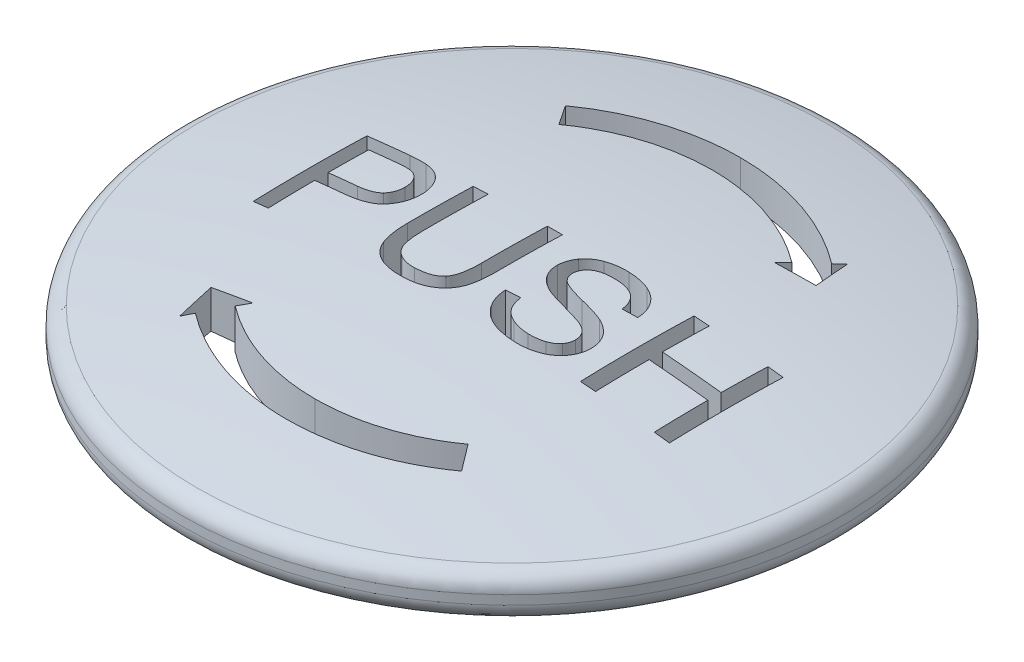
from build123d import *

# Parameters (mm, degrees)
SKETCH2_R           = 10
BOSS_EXTRUDE2_DEPTH = 10
SKETCH9_R           = 18
CUT_EXTRUDE4_DEPTH  = 1.5
SKETCH10_R          = 18
CUT_EXTRUDE5_DEPTH  = 24.9
CUT_EXTRUDE9_DEPTH  = 24.9


with BuildPart() as part:
    # Sketch2 → Boss-Extrude2 (new body)
    with BuildSketch(Plane(origin=(0, 0, 0), x_dir=(1, 0, 0), z_dir=(0, 1, 0))):
        with Locations(Location((0, 0, 0), (0, 0, 270))):
            Circle(SKETCH2_R)
    extrude(amount=BOSS_EXTRUDE2_DEPTH)

    # Sketch4 → Revolve1 (revolve)
    with BuildSketch(Plane.XY, mode=Mode.PRIVATE) as revolve1_sk:
        with BuildLine():
            Line((0, 10), (0, 15))
            ThreePointArc((0, 15), (10.806929535, 14.498925094), (21.521126919, 13))
            ThreePointArc((21.521126919, 13), (22.223404652, 12.586920321), (22.5, 11.820549753))
            Line((22.5, 11.820549753), (22.5, 11.2))
            ThreePointArc((22.5, 11.2), (22.148528137, 10.351471863), (21.3, 10))
            Line((21.3, 10), (0, 10))
        make_face()
    revolve(revolve1_sk.sketch.rotate(Axis((0, 10, 0), (0, 1, 0)), 90), axis=Axis((0, 10, 0), (0, 1, 0)))

    # Sketch9 → Cut-Extrude4 (cut)
    with BuildSketch(Plane.XZ.offset(-10)):
        with Locations(Location((0, 0, 0), (0, 0, 270))):
            Circle(SKETCH9_R)
    extrude(amount=-CUT_EXTRUDE4_DEPTH, mode=Mode.SUBTRACT)


with BuildPart() as cut_extrude4_piece_1:
    # of the separate pieces the step leaves, piece 1, a body of its own (cut_extrude4_pieces)
    add(part.part.solids().sort_by_distance((0, 15, 0))[0])

    # Sketch16 → Cut-Extrude9 (cut)
    # profile 1 of 6: a face of its own
    with BuildSketch(Plane(origin=(0, 0, 0), x_dir=(1, 0, 0), z_dir=(0, 1, 0))):
        with BuildLine():
            Line((10.256560718, 10.500710718), (7.684000718, 10.221350718))
            Line((7.684000718, 10.221350718), (8.206900718, 10.901930718))
            add(Edge.make_bspline(
                [(8.206900718, 10.901930718), (5.845840718, 12.699050718), (2.960440718, 13.672130718), (-0.006679282, 13.672130718)],
                knots=[0.2, 0.2, 0.2, 0.2, 0.3, 0.3, 0.3, 0.3], degree=3))
            add(Edge.make_bspline(
                [(-0.006679282, 13.672130718), (-2.845639282, 13.672130718), (-5.613679282, 12.782030718), (-7.919299282, 11.125490718)],
                knots=[0.3, 0.3, 0.3, 0.3, 0.4, 0.4, 0.4, 0.4], degree=3))
            Line((-7.919299282, 11.125490718), (-9.049159282, 12.698330718))
            add(Edge.make_bspline(
                [(-9.049159282, 12.698330718), (-6.414139282, 14.591210718), (-3.251179282, 15.609470718), (-0.006679282, 15.609470718)],
                knots=[0.5, 0.5, 0.5, 0.5, 0.6, 0.6, 0.6, 0.6], degree=3))
            add(Edge.make_bspline(
                [(-0.006679282, 15.609470718), (3.384340718, 15.609470718), (6.682120718, 14.497610718), (9.380500718, 12.443990718)],
                knots=[0.6, 0.6, 0.6, 0.6, 0.7, 0.7, 0.7, 0.7], degree=3))
            Line((9.380500718, 12.443990718), (9.841120718, 13.049150718))
            Line((9.841120718, 13.049150718), (10.256560718, 10.500710718))
        make_face()
    # profile 2 of 6: a face of its own
    with BuildSketch(Plane(origin=(0, 0, 0), x_dir=(1, 0, 0), z_dir=(0, 1, 0))):
        with BuildLine():
            Line((-10.269919282, -10.279569282), (-7.697359282, -10.000209282))
            Line((-7.697359282, -10.000209282), (-8.220259282, -10.680789282))
            add(Edge.make_bspline(
                [(-8.220259282, -10.680789282), (-5.859199282, -12.477909282), (-2.973799282, -13.450989282), (-0.006679282, -13.450989282)],
                knots=[0.2, 0.2, 0.2, 0.2, 0.3, 0.3, 0.3, 0.3], degree=3))
            add(Edge.make_bspline(
                [(-0.006679282, -13.450989282), (2.832280718, -13.450989282), (5.600320718, -12.560889282), (7.905940718, -10.904349282)],
                knots=[0.3, 0.3, 0.3, 0.3, 0.4, 0.4, 0.4, 0.4], degree=3))
            Line((7.905940718, -10.904349282), (9.035800718, -12.477189282))
            add(Edge.make_bspline(
                [(9.035800718, -12.477189282), (6.400780718, -14.370069282), (3.237820718, -15.388329282), (-0.006679282, -15.388329282)],
                knots=[0.5, 0.5, 0.5, 0.5, 0.6, 0.6, 0.6, 0.6], degree=3))
            add(Edge.make_bspline(
                [(-0.006679282, -15.388329282), (-3.397699282, -15.388329282), (-6.695479282, -14.276469282), (-9.393859282, -12.222849282)],
                knots=[0.6, 0.6, 0.6, 0.6, 0.7, 0.7, 0.7, 0.7], degree=3))
            Line((-9.393859282, -12.222849282), (-9.854479282, -12.828009282))
            Line((-9.854479282, -12.828009282), (-10.269919282, -10.279569282))
        make_face()
    # profile 3 of 6: a face of its own
    with BuildSketch(Plane(origin=(0, 0, 0), x_dir=(1, 0, 0), z_dir=(0, 1, 0))):
        with BuildLine():
            Line((-13.895839282, -3.771669282), (-13.895839282, 3.992630718))
            Line((-13.895839282, 3.992630718), (-10.964359282, 3.992630718))
            add(Edge.make_bspline(
                [(-10.964359282, 3.992630718), (-10.449379282, 3.992630718), (-10.055359282, 3.967250718), (-9.782479282, 3.918470718)],
                knots=[0.166666667, 0.166666667, 0.166666667, 0.166666667, 0.25, 0.25, 0.25, 0.25], degree=3))
            add(Edge.make_bspline(
                [(-9.782479282, 3.918470718), (-9.401059282, 3.855290718), (-9.081199282, 3.734150718), (-8.822719282, 3.557030718)],
                knots=[0.25, 0.25, 0.25, 0.25, 0.333333333, 0.333333333, 0.333333333, 0.333333333], degree=3))
            add(Edge.make_bspline(
                [(-8.822719282, 3.557030718), (-8.564239282, 3.378110718), (-8.356519282, 3.128630718), (-8.199199282, 2.808770718)],
                knots=[0.333333333, 0.333333333, 0.333333333, 0.333333333, 0.416666667, 0.416666667, 0.416666667, 0.416666667], degree=3))
            add(Edge.make_bspline(
                [(-8.199199282, 2.808770718), (-8.041879282, 2.488910718), (-7.964299282, 2.136470718), (-7.964299282, 1.751450718)],
                knots=[0.416666667, 0.416666667, 0.416666667, 0.416666667, 0.5, 0.5, 0.5, 0.5], degree=3))
            add(Edge.make_bspline(
                [(-7.964299282, 1.751450718), (-7.964299282, 1.093550718), (-8.173819282, 0.535190718), (-8.595019282, 0.079790718)],
                knots=[0.5, 0.5, 0.5, 0.5, 0.583333333, 0.583333333, 0.583333333, 0.583333333], degree=3))
            add(Edge.make_bspline(
                [(-8.595019282, 0.079790718), (-9.014239282, -0.377589282), (-9.775099282, -0.605289282), (-10.873999282, -0.605289282)],
                knots=[0.583333333, 0.583333333, 0.583333333, 0.583333333, 0.666666667, 0.666666667, 0.666666667, 0.666666667], degree=3))
            Line((-10.873999282, -0.605289282), (-12.865699282, -0.605289282))
            Line((-12.865699282, -0.605289282), (-12.865699282, -3.771669282))
            Line((-12.865699282, -3.771669282), (-13.895839282, -3.771669282))
        make_face()
        with BuildLine():
            Line((-12.865699282, 0.305690718), (-10.859599282, 0.305690718))
            add(Edge.make_bspline(
                [(-10.859599282, 0.305690718), (-10.194499282, 0.305690718), (-9.724519282, 0.428630718), (-9.444439282, 0.676130718)],
                knots=[0.111111111, 0.111111111, 0.111111111, 0.111111111, 0.222222222, 0.222222222, 0.222222222, 0.222222222], degree=3))
            add(Edge.make_bspline(
                [(-9.444439282, 0.676130718), (-9.166159282, 0.923810718), (-9.027019282, 1.270670718), (-9.027019282, 1.720850718)],
                knots=[0.222222222, 0.222222222, 0.222222222, 0.222222222, 0.333333333, 0.333333333, 0.333333333, 0.333333333], degree=3))
            add(Edge.make_bspline(
                [(-9.027019282, 1.720850718), (-9.027019282, 2.044310718), (-9.108199282, 2.322590718), (-9.272719282, 2.553890718)],
                knots=[0.333333333, 0.333333333, 0.333333333, 0.333333333, 0.444444444, 0.444444444, 0.444444444, 0.444444444], degree=3))
            add(Edge.make_bspline(
                [(-9.272719282, 2.553890718), (-9.437239282, 2.785370718), (-9.654139282, 2.938910718), (-9.921619282, 3.013070718)],
                knots=[0.444444444, 0.444444444, 0.444444444, 0.444444444, 0.555555556, 0.555555556, 0.555555556, 0.555555556], degree=3))
            add(Edge.make_bspline(
                [(-9.921619282, 3.013070718), (-10.095139282, 3.058250718), (-10.414999282, 3.081650718), (-10.879399282, 3.081650718)],
                knots=[0.555555556, 0.555555556, 0.555555556, 0.555555556, 0.666666667, 0.666666667, 0.666666667, 0.666666667], degree=3))
            Line((-10.879399282, 3.081650718), (-12.865699282, 3.081650718))
            Line((-12.865699282, 3.081650718), (-12.865699282, 0.305690718))
        make_face(mode=Mode.SUBTRACT)
    # profile 4 of 6: a face of its own
    with BuildSketch(Plane(origin=(0, 0, 0), x_dir=(1, 0, 0), z_dir=(0, 1, 0))):
        with BuildLine():
            Line((-1.577179282, 3.992630718), (-0.547039282, 3.992630718))
            Line((-0.547039282, 3.992630718), (-0.547039282, -0.491349282))
            add(Edge.make_bspline(
                [(-0.547039282, -0.491349282), (-0.547039282, -1.272189282), (-0.635599282, -1.892109282), (-0.810919282, -2.351109282)],
                knots=[0.111111111, 0.111111111, 0.111111111, 0.111111111, 0.166666667, 0.166666667, 0.166666667, 0.166666667], degree=3))
            add(Edge.make_bspline(
                [(-0.810919282, -2.351109282), (-0.988039282, -2.808309282), (-1.306099282, -3.182529282), (-1.765099282, -3.469809282)],
                knots=[0.166666667, 0.166666667, 0.166666667, 0.166666667, 0.222222222, 0.222222222, 0.222222222, 0.222222222], degree=3))
            add(Edge.make_bspline(
                [(-1.765099282, -3.469809282), (-2.225899282, -3.757269282), (-2.827819282, -3.901809282), (-3.576079282, -3.901809282)],
                knots=[0.222222222, 0.222222222, 0.222222222, 0.222222222, 0.277777778, 0.277777778, 0.277777778, 0.277777778], degree=3))
            add(Edge.make_bspline(
                [(-3.576079282, -3.901809282), (-4.300759282, -3.901809282), (-4.895299282, -3.777069282), (-5.356279282, -3.525789282)],
                knots=[0.277777778, 0.277777778, 0.277777778, 0.277777778, 0.333333333, 0.333333333, 0.333333333, 0.333333333], degree=3))
            add(Edge.make_bspline(
                [(-5.356279282, -3.525789282), (-5.818879282, -3.274689282), (-6.147919282, -2.913249282), (-6.344839282, -2.437869282)],
                knots=[0.333333333, 0.333333333, 0.333333333, 0.333333333, 0.388888889, 0.388888889, 0.388888889, 0.388888889], degree=3))
            add(Edge.make_bspline(
                [(-6.344839282, -2.437869282), (-6.541759282, -1.962489282), (-6.641299282, -1.313769282), (-6.641299282, -0.491349282)],
                knots=[0.388888889, 0.388888889, 0.388888889, 0.388888889, 0.444444444, 0.444444444, 0.444444444, 0.444444444], degree=3))
            Line((-6.641299282, -0.491349282), (-6.641299282, 3.992630718))
            Line((-6.641299282, 3.992630718), (-5.611159282, 3.992630718))
            Line((-5.611159282, 3.992630718), (-5.611159282, -0.489549282))
            add(Edge.make_bspline(
                [(-5.611159282, -0.489549282), (-5.611159282, -1.163649282), (-5.547799282, -1.662609282), (-5.423059282, -1.980669282)],
                knots=[0.611111111, 0.611111111, 0.611111111, 0.611111111, 0.666666667, 0.666666667, 0.666666667, 0.666666667], degree=3))
            add(Edge.make_bspline(
                [(-5.423059282, -1.980669282), (-5.298499282, -2.300529282), (-5.085199282, -2.548029282), (-4.779739282, -2.719749282)],
                knots=[0.666666667, 0.666666667, 0.666666667, 0.666666667, 0.722222222, 0.722222222, 0.722222222, 0.722222222], degree=3))
            add(Edge.make_bspline(
                [(-4.779739282, -2.719749282), (-4.476079282, -2.893269282), (-4.103839282, -2.980029282), (-3.664639282, -2.980029282)],
                knots=[0.722222222, 0.722222222, 0.722222222, 0.722222222, 0.777777778, 0.777777778, 0.777777778, 0.777777778], degree=3))
            add(Edge.make_bspline(
                [(-3.664639282, -2.980029282), (-2.912779282, -2.980029282), (-2.376019282, -2.808309282), (-2.056159282, -2.466849282)],
                knots=[0.777777778, 0.777777778, 0.777777778, 0.777777778, 0.833333333, 0.833333333, 0.833333333, 0.833333333], degree=3))
            add(Edge.make_bspline(
                [(-2.056159282, -2.466849282), (-1.736119282, -2.123409282), (-1.577179282, -1.465509282), (-1.577179282, -0.489549282)],
                knots=[0.833333333, 0.833333333, 0.833333333, 0.833333333, 0.888888889, 0.888888889, 0.888888889, 0.888888889], degree=3))
            Line((-1.577179282, -0.489549282), (-1.577179282, 3.992630718))
        make_face()
    # profile 5 of 6: a face of its own
    with BuildSketch(Plane(origin=(0, 0, 0), x_dir=(1, 0, 0), z_dir=(0, 1, 0))):
        with BuildLine():
            Line((0.831940718, -1.277589282), (1.797100718, -1.190829282))
            add(Edge.make_bspline(
                [(1.797100718, -1.190829282), (1.842280718, -1.581249282), (1.948840718, -1.901109282), (2.116960718, -2.152389282)],
                knots=[0.027777778, 0.027777778, 0.027777778, 0.027777778, 0.055555556, 0.055555556, 0.055555556, 0.055555556], degree=3))
            add(Edge.make_bspline(
                [(2.116960718, -2.152389282), (2.285080718, -2.401689282), (2.545360718, -2.604189282), (2.897800718, -2.759529282)],
                knots=[0.055555556, 0.055555556, 0.055555556, 0.055555556, 0.083333333, 0.083333333, 0.083333333, 0.083333333], degree=3))
            add(Edge.make_bspline(
                [(2.897800718, -2.759529282), (3.250240718, -2.913249282), (3.647860718, -2.990829282), (4.088860718, -2.990829282)],
                knots=[0.083333333, 0.083333333, 0.083333333, 0.083333333, 0.111111111, 0.111111111, 0.111111111, 0.111111111], degree=3))
            add(Edge.make_bspline(
                [(4.088860718, -2.990829282), (4.480900718, -2.990829282), (4.826140718, -2.933049282), (5.126200718, -2.815509282)],
                knots=[0.111111111, 0.111111111, 0.111111111, 0.111111111, 0.138888889, 0.138888889, 0.138888889, 0.138888889], degree=3))
            add(Edge.make_bspline(
                [(5.126200718, -2.815509282), (5.426260718, -2.698149282), (5.648560718, -2.537229282), (5.794900718, -2.333109282)],
                knots=[0.138888889, 0.138888889, 0.138888889, 0.138888889, 0.166666667, 0.166666667, 0.166666667, 0.166666667], degree=3))
            add(Edge.make_bspline(
                [(5.794900718, -2.333109282), (5.941240718, -2.128809282), (6.015400718, -1.906509282), (6.015400718, -1.668009282)],
                knots=[0.166666667, 0.166666667, 0.166666667, 0.166666667, 0.194444444, 0.194444444, 0.194444444, 0.194444444], degree=3))
            add(Edge.make_bspline(
                [(6.015400718, -1.668009282), (6.015400718, -1.425729282), (5.944840718, -1.214229282), (5.803900718, -1.031709282)],
                knots=[0.194444444, 0.194444444, 0.194444444, 0.194444444, 0.222222222, 0.222222222, 0.222222222, 0.222222222], degree=3))
            add(Edge.make_bspline(
                [(5.803900718, -1.031709282), (5.662960718, -0.850989282), (5.429860718, -0.699249282), (5.104420718, -0.574509282)],
                knots=[0.222222222, 0.222222222, 0.222222222, 0.222222222, 0.25, 0.25, 0.25, 0.25], degree=3))
            add(Edge.make_bspline(
                [(5.104420718, -0.574509282), (4.896700718, -0.494949282), (4.435720718, -0.368409282), (3.721840718, -0.196869282)],
                knots=[0.25, 0.25, 0.25, 0.25, 0.277777778, 0.277777778, 0.277777778, 0.277777778], degree=3))
            add(Edge.make_bspline(
                [(3.721840718, -0.196869282), (3.007960718, -0.025149282), (2.509180718, 0.135770718), (2.223700718, 0.287510718)],
                knots=[0.277777778, 0.277777778, 0.277777778, 0.277777778, 0.305555556, 0.305555556, 0.305555556, 0.305555556], degree=3))
            add(Edge.make_bspline(
                [(2.223700718, 0.287510718), (1.853080718, 0.482810718), (1.578400718, 0.724910718), (1.397680718, 1.012370718)],
                knots=[0.305555556, 0.305555556, 0.305555556, 0.305555556, 0.333333333, 0.333333333, 0.333333333, 0.333333333], degree=3))
            add(Edge.make_bspline(
                [(1.397680718, 1.012370718), (1.215160718, 1.299650718), (1.124800718, 1.623110718), (1.124800718, 1.979150718)],
                knots=[0.333333333, 0.333333333, 0.333333333, 0.333333333, 0.361111111, 0.361111111, 0.361111111, 0.361111111], degree=3))
            add(Edge.make_bspline(
                [(1.124800718, 1.979150718), (1.124800718, 2.373170718), (1.236760718, 2.740190718), (1.459060718, 3.079850718)],
                knots=[0.361111111, 0.361111111, 0.361111111, 0.361111111, 0.388888889, 0.388888889, 0.388888889, 0.388888889], degree=3))
            add(Edge.make_bspline(
                [(1.459060718, 3.079850718), (1.681360718, 3.421490718), (2.005000718, 3.679970718), (2.433220718, 3.857090718)],
                knots=[0.388888889, 0.388888889, 0.388888889, 0.388888889, 0.416666667, 0.416666667, 0.416666667, 0.416666667], degree=3))
            add(Edge.make_bspline(
                [(2.433220718, 3.857090718), (2.859820718, 4.034210718), (3.335200718, 4.122770718), (3.857380718, 4.122770718)],
                knots=[0.416666667, 0.416666667, 0.416666667, 0.416666667, 0.444444444, 0.444444444, 0.444444444, 0.444444444], degree=3))
            add(Edge.make_bspline(
                [(3.857380718, 4.122770718), (4.432120718, 4.122770718), (4.940080718, 4.030610718), (5.379280718, 3.844310718)],
                knots=[0.444444444, 0.444444444, 0.444444444, 0.444444444, 0.472222222, 0.472222222, 0.472222222, 0.472222222], degree=3))
            add(Edge.make_bspline(
                [(5.379280718, 3.844310718), (5.818300718, 3.659990718), (6.156340718, 3.387110718), (6.393040718, 3.025670718)],
                knots=[0.472222222, 0.472222222, 0.472222222, 0.472222222, 0.5, 0.5, 0.5, 0.5], degree=3))
            add(Edge.make_bspline(
                [(6.393040718, 3.025670718), (6.629920718, 2.666030718), (6.756460718, 2.257610718), (6.774460718, 1.802030718)],
                knots=[0.5, 0.5, 0.5, 0.5, 0.527777778, 0.527777778, 0.527777778, 0.527777778], degree=3))
            Line((6.774460718, 1.802030718), (5.787700718, 1.726250718))
            add(Edge.make_bspline(
                [(5.787700718, 1.726250718), (5.735320718, 2.216030718), (5.556400718, 2.586470718), (5.250940718, 2.835950718)],
                knots=[0.555555556, 0.555555556, 0.555555556, 0.555555556, 0.583333333, 0.583333333, 0.583333333, 0.583333333], degree=3))
            add(Edge.make_bspline(
                [(5.250940718, 2.835950718), (4.945480718, 3.087050718), (4.493680718, 3.211790718), (3.897160718, 3.211790718)],
                knots=[0.583333333, 0.583333333, 0.583333333, 0.583333333, 0.611111111, 0.611111111, 0.611111111, 0.611111111], degree=3))
            add(Edge.make_bspline(
                [(3.897160718, 3.211790718), (3.275440718, 3.211790718), (2.821840718, 3.098030718), (2.538160718, 2.870150718)],
                knots=[0.611111111, 0.611111111, 0.611111111, 0.611111111, 0.638888889, 0.638888889, 0.638888889, 0.638888889], degree=3))
            add(Edge.make_bspline(
                [(2.538160718, 2.870150718), (2.254300718, 2.642450718), (2.111560718, 2.367770718), (2.111560718, 2.046110718)],
                knots=[0.638888889, 0.638888889, 0.638888889, 0.638888889, 0.666666667, 0.666666667, 0.666666667, 0.666666667], degree=3))
            add(Edge.make_bspline(
                [(2.111560718, 2.046110718), (2.111560718, 1.767830718), (2.212720718, 1.538150718), (2.413420718, 1.357430718)],
                knots=[0.666666667, 0.666666667, 0.666666667, 0.666666667, 0.694444444, 0.694444444, 0.694444444, 0.694444444], degree=3))
            add(Edge.make_bspline(
                [(2.413420718, 1.357430718), (2.612140718, 1.178510718), (3.127300718, 0.992390718), (3.962320718, 0.804470718)],
                knots=[0.694444444, 0.694444444, 0.694444444, 0.694444444, 0.722222222, 0.722222222, 0.722222222, 0.722222222], degree=3))
            add(Edge.make_bspline(
                [(3.962320718, 0.804470718), (4.797160718, 0.614750718), (5.370100718, 0.450230718), (5.680960718, 0.309290718)],
                knots=[0.722222222, 0.722222222, 0.722222222, 0.722222222, 0.75, 0.75, 0.75, 0.75], degree=3))
            add(Edge.make_bspline(
                [(5.680960718, 0.309290718), (6.130960718, 0.101390718), (6.465400718, -0.160689282), (6.680500718, -0.480549282)],
                knots=[0.75, 0.75, 0.75, 0.75, 0.777777778, 0.777777778, 0.777777778, 0.777777778], degree=3))
            add(Edge.make_bspline(
                [(6.680500718, -0.480549282), (6.895600718, -0.798609282), (7.002160718, -1.165449282), (7.002160718, -1.581249282)],
                knots=[0.777777778, 0.777777778, 0.777777778, 0.777777778, 0.805555556, 0.805555556, 0.805555556, 0.805555556], degree=3))
            add(Edge.make_bspline(
                [(7.002160718, -1.581249282), (7.002160718, -1.995069282), (6.884620718, -2.381889282), (6.647920718, -2.746929282)],
                knots=[0.805555556, 0.805555556, 0.805555556, 0.805555556, 0.833333333, 0.833333333, 0.833333333, 0.833333333], degree=3))
            add(Edge.make_bspline(
                [(6.647920718, -2.746929282), (6.411220718, -3.111969282), (6.073180718, -3.395829282), (5.630380718, -3.598149282)],
                knots=[0.833333333, 0.833333333, 0.833333333, 0.833333333, 0.861111111, 0.861111111, 0.861111111, 0.861111111], degree=3))
            add(Edge.make_bspline(
                [(5.630380718, -3.598149282), (5.187580718, -3.800649282), (4.690600718, -3.901809282), (4.135840718, -3.901809282)],
                knots=[0.861111111, 0.861111111, 0.861111111, 0.861111111, 0.888888889, 0.888888889, 0.888888889, 0.888888889], degree=3))
            add(Edge.make_bspline(
                [(4.135840718, -3.901809282), (3.434560718, -3.901809282), (2.847220718, -3.798849282), (2.373640718, -3.594549282)],
                knots=[0.888888889, 0.888888889, 0.888888889, 0.888888889, 0.916666667, 0.916666667, 0.916666667, 0.916666667], degree=3))
            add(Edge.make_bspline(
                [(2.373640718, -3.594549282), (1.898260718, -3.390249282), (1.527820718, -3.083169282), (1.258540718, -2.670969282)],
                knots=[0.916666667, 0.916666667, 0.916666667, 0.916666667, 0.944444444, 0.944444444, 0.944444444, 0.944444444], degree=3))
            add(Edge.make_bspline(
                [(1.258540718, -2.670969282), (0.987460718, -2.260749282), (0.846520718, -1.796349282), (0.831940718, -1.277589282)],
                knots=[0.944444444, 0.944444444, 0.944444444, 0.944444444, 1, 1, 1, 1], degree=3))
        make_face()
    # profile 6 of 6: a face of its own
    with BuildSketch(Plane(origin=(0, 0, 0), x_dir=(1, 0, 0), z_dir=(0, 1, 0))):
        Polygon((8.444500718, -3.771669282), (8.444500718, 3.992630718), (9.474640718, 3.992630718), (9.474640718, 0.793670718), (13.486840718, 0.793670718), (13.486840718, 3.992630718), (14.516980718, 3.992630718), (14.516980718, -3.771669282), (13.486840718, -3.771669282), (13.486840718, -0.117309282), (9.474640718, -0.117309282), (9.474640718, -3.771669282), align=None)
    extrude(amount=CUT_EXTRUDE9_DEPTH, mode=Mode.SUBTRACT)


with BuildPart() as cut_extrude4_piece_2:
    # of the separate pieces the step leaves, piece 2, a body of its own (cut_extrude4_pieces)
    add(part.part.solids().sort_by_distance((0, 0, 10))[0])

    # Sketch10 → Cut-Extrude5 (cut)
    with BuildSketch(Plane.XZ.offset(-11.5)):
        with Locations(Location((0, 0, 0), (0, 0, 270))):
            Circle(SKETCH10_R)
    extrude(amount=CUT_EXTRUDE5_DEPTH, mode=Mode.SUBTRACT)


with BuildPart() as cut_extrude9_piece_1:
    # of the separate pieces the step leaves, piece 1, a body of its own (cut_extrude9_pieces)
    add(cut_extrude4_piece_1.part.solids().sort_by_distance((0, 15, 0))[0])


with BuildPart() as cut_extrude9_piece_2:
    # of the separate pieces the step leaves, piece 2, a body of its own (cut_extrude9_pieces)
    add(cut_extrude4_piece_1.part.solids().sort_by_distance((-12.865699282, 14.288783787, -0.305690718))[0])


solid = Compound([cut_extrude9_piece_1.part, cut_extrude9_piece_2.part])
